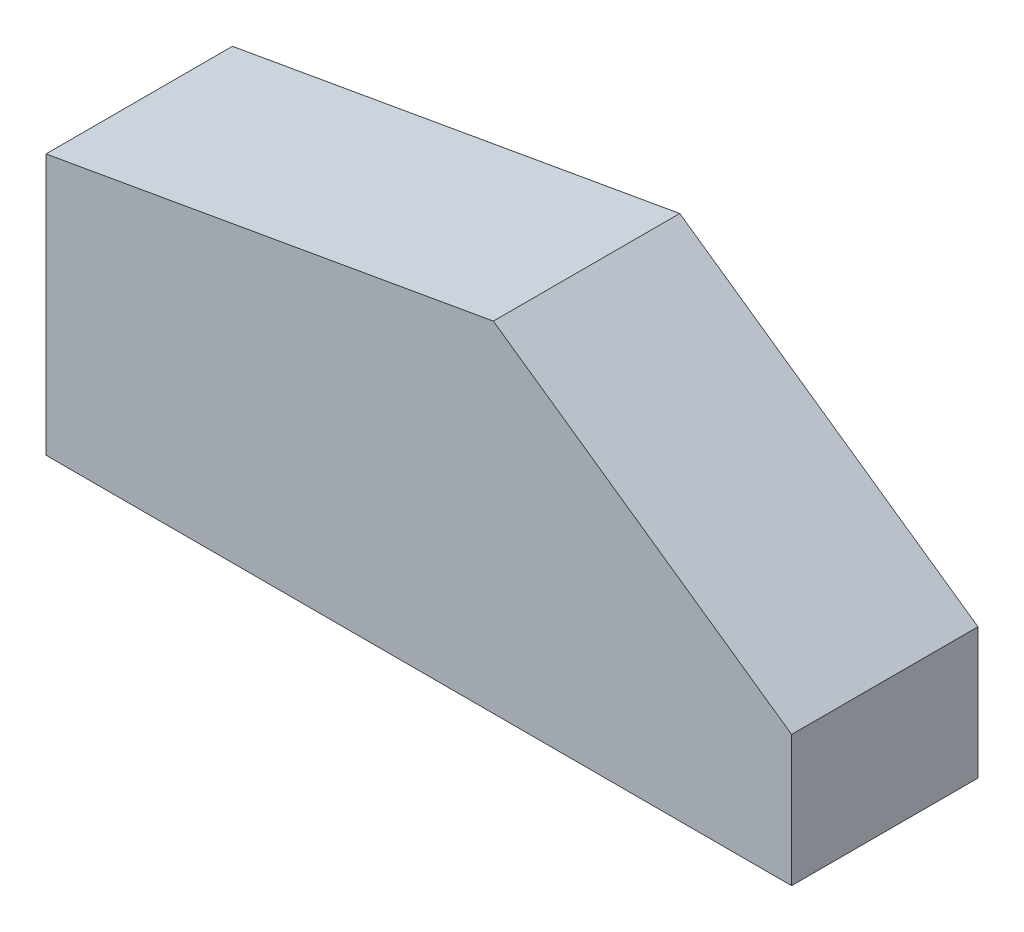
from build123d import *

# Parameters (mm, degrees)
BOSS_EXTRUDE1_DEPTH = 25


with BuildPart() as part:
    # Sketch3 → Boss-Extrude1 (new body)
    with BuildSketch(Plane.XY):
        Polygon((-25, 95), (-25, 130), (35, 140.579618843), (75, 112.571317314), (75, 95), align=None)
    extrude(amount=BOSS_EXTRUDE1_DEPTH)


solid = part.part
